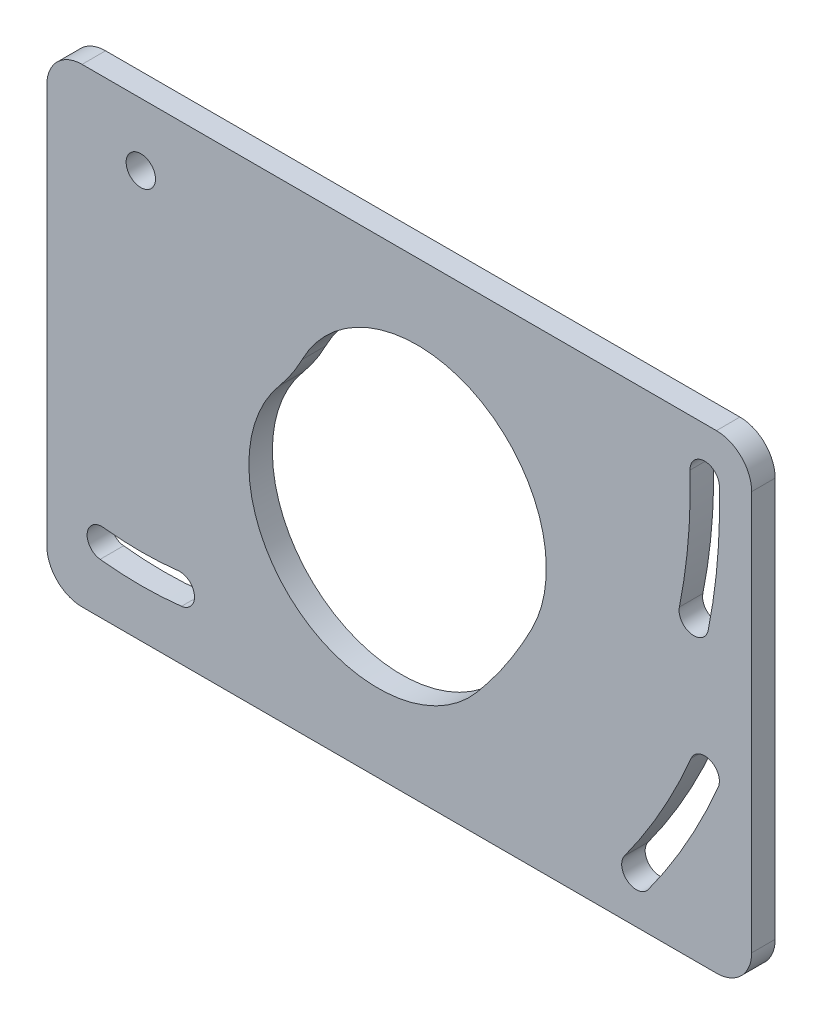
from build123d import *

# Parameters (mm, degrees)
SZKIC1_R                    = 1.25
DODANIE_WYCI_GNI_CIE1_DEPTH = 2


with BuildPart() as part:
    # Szkic1 → Dodanie-wyciągnięcie1 (new body)
    with BuildSketch(Plane.XY):
        with BuildLine():
            Line((-27, -20), (27, -20))
            ThreePointArc((27, -20), (29.121320344, -19.121320344), (30, -17))
            Line((30, -17), (30, 17))
            ThreePointArc((30, 17), (29.121320344, 19.121320344), (27, 20))
            Line((27, 20), (-27, 20))
            ThreePointArc((-27, 20), (-29.121320344, 19.121320344), (-30, 17))
            Line((-30, 17), (-30, -17))
            ThreePointArc((-30, -17), (-29.121320344, -19.121320344), (-27, -20))
        make_face()
        with Locations((-22, 14.666666667)):
            Circle(SZKIC1_R, mode=Mode.SUBTRACT)
        with BuildLine():
            ThreePointArc((-25.462131621, -15.720072586), (-22, -15.916666667), (-18.537868379, -15.720072586))
            ThreePointArc((-18.537868379, -15.720072586), (-17.437407577, -14.336603749), (-18.820876413, -13.236142947))
            ThreePointArc((-18.820876413, -13.236142947), (-22, -13.416666667), (-25.179123587, -13.236142947))
            ThreePointArc((-25.179123587, -13.236142947), (-26.562592423, -14.336603749), (-25.462131621, -15.720072586))
        make_face(mode=Mode.SUBTRACT)
        with BuildLine():
            ThreePointArc((26.294998597, 4.920914996), (27.087801786, 10.450711145), (27.249518026, 16.034708834))
            ThreePointArc((27.249518026, 16.034708834), (25.965291166, 17.249518026), (24.750481974, 15.965291166))
            ThreePointArc((24.750481974, 15.965291166), (24.596971596, 10.664638616), (23.8443971, 5.415437293))
            ThreePointArc((23.8443971, 5.415437293), (24.8224367, 3.942875396), (26.294998597, 4.920914996))
        make_face(mode=Mode.SUBTRACT)
        with BuildLine():
            ThreePointArc((21.193691844, -16.735032503), (24.470809822, -11.643513117), (27.150485656, -6.213742466))
            ThreePointArc((27.150485656, -6.213742466), (26.488756334, -4.574500475), (24.849514344, -5.236229797))
            ThreePointArc((24.849514344, -5.236229797), (22.295287061, -10.411806693), (19.171586782, -15.264967497))
            ThreePointArc((19.171586782, -15.264967497), (19.44760681, -17.011052531), (21.193691844, -16.735032503))
        make_face(mode=Mode.SUBTRACT)
        with BuildLine():
            ThreePointArc((6.601254034, -9.49476923), (9.152553238, -6.101702158), (11.303346225, -2.441630943))
            ThreePointArc((11.303346225, -2.441630943), (6.545275723, 12.369201751), (-8.265556972, 7.611131249))
            ThreePointArc((-8.265556972, 7.611131249), (-9.152553238, 6.101702158), (-10.204719988, 4.702386724))
            ThreePointArc((-10.204719988, 4.702386724), (-8.900310954, -10.799178264), (6.601254034, -9.49476923))
        make_face(mode=Mode.SUBTRACT)
    extrude(amount=DODANIE_WYCI_GNI_CIE1_DEPTH)


solid = part.part
